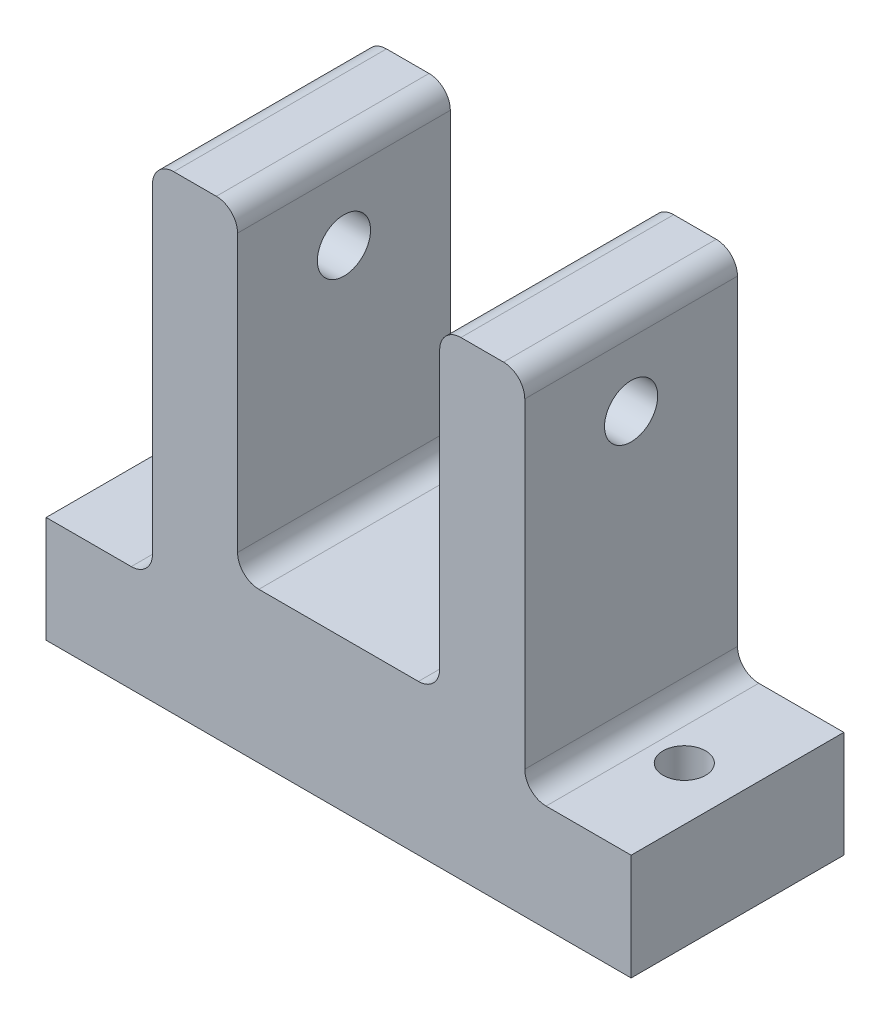
from build123d import *

# Parameters (mm, degrees)
SKETCH1_W               = 35
SKETCH1_H               = 20
BOSS_EXTRUDE1_DEPTH     = 44.15
SKETCH2_W               = 19
SKETCH2_H               = 20
CUT_EXTRUDE1_DEPTH      = 30
CUT_EXTRUDE2_DEPTH      = 58.220822259
CUT_EXTRUDE2_DEPTH_BACK = 58.220822259
SKETCH3_R               = 2.5
FILLET1_R               = 2
SKETCH4_W               = 10
SKETCH4_H               = 20
SKETCH4_R               = 2
BOSS_EXTRUDE2_DEPTH     = 10
FILLET2_R               = 2


with BuildPart() as part:
    # Sketch1 → Boss-Extrude1 (new body)
    with BuildSketch(Plane(origin=(0, 0, 0), x_dir=(1, 0, 0), z_dir=(0, 1, 0))):
        Rectangle(SKETCH1_W, SKETCH1_H)
    extrude(amount=BOSS_EXTRUDE1_DEPTH)

    # Sketch2 → Cut-Extrude1 (cut)
    with BuildSketch(Plane(origin=(0, 44.15, 0), x_dir=(1, 0, 0), z_dir=(0, 1, 0))):
        Rectangle(SKETCH2_W, SKETCH2_H)
    extrude(amount=-CUT_EXTRUDE1_DEPTH, mode=Mode.SUBTRACT)

    # Sketch3 → Cut-Extrude2 (cut, two sides: drawn at the far end of the back side and taken through both)
    with BuildSketch(Plane(origin=(17.5, 0, 0), x_dir=(0, 0, -1), z_dir=(1, 0, 0)).offset(-CUT_EXTRUDE2_DEPTH_BACK)):
        with Locations((0, 36.15)):
            Circle(SKETCH3_R)
    extrude(amount=CUT_EXTRUDE2_DEPTH + CUT_EXTRUDE2_DEPTH_BACK, mode=Mode.SUBTRACT)

    # Fillet1
    fillet1_edges = [part.edges().sort_by_distance(p)[0] for p in [
        (9.5, 14.15, 0),
        (-9.5, 14.15, 0),
        (9.5, 44.15, 0),
        (-9.5, 44.15, 0),
    ]]
    fillet(fillet1_edges, radius=FILLET1_R)

    # Sketch4 → Boss-Extrude2 (add)
    # profile 1 of 2: a face of its own
    with BuildSketch(Plane.XZ):
        with Locations((22.5, 0)):
            Rectangle(SKETCH4_W, SKETCH4_H)
        with Locations(Location((22.5, 0, 0), (0, 0, 270))):
            Circle(SKETCH4_R, mode=Mode.SUBTRACT)
    # profile 2 of 2: a face of its own
    with BuildSketch(Plane.XZ):
        with Locations((-22.5, 0)):
            Rectangle(SKETCH4_W, SKETCH4_H)
        with Locations(Location((-22.5, 0, 0), (0, 0, 90))):
            Circle(SKETCH4_R, mode=Mode.SUBTRACT)
    extrude(amount=-BOSS_EXTRUDE2_DEPTH)

    # Fillet2
    fillet2_edges = [part.edges().sort_by_distance(p)[0] for p in [
        (-17.5, 44.15, 0),
        (17.5, 44.15, 0),
        (17.5, 10, 0),
        (-17.5, 10, 0),
    ]]
    fillet(fillet2_edges, radius=FILLET2_R)


solid = part.part
